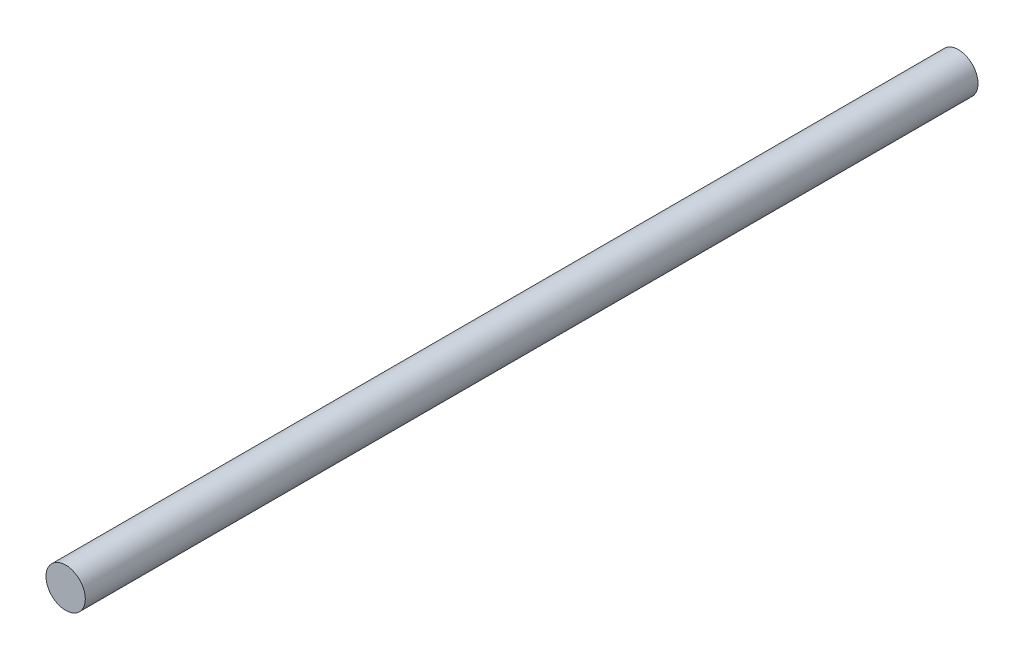
from build123d import *

# Parameters (mm, degrees)
SKETCH_1_R          = 0.7
EXTRUDE_1_DEPTH     = 35
SKETCH_2_R          = 1.414954106
CUT_EXTRUDE_2_DEPTH = 3.2


with BuildPart() as part:
    # 草图1 → 凸台-拉伸1 (new body)
    with BuildSketch(Plane.XY):
        Circle(SKETCH_1_R)
    extrude(amount=EXTRUDE_1_DEPTH)

    # 草图2 → 切除-拉伸2 (cut)
    with BuildSketch(Plane(origin=(0, 0, 0), x_dir=(-1, 0, 0), z_dir=(0, 0, -1))):
        Circle(SKETCH_2_R)
    extrude(amount=-CUT_EXTRUDE_2_DEPTH, mode=Mode.SUBTRACT)


solid = part.part
